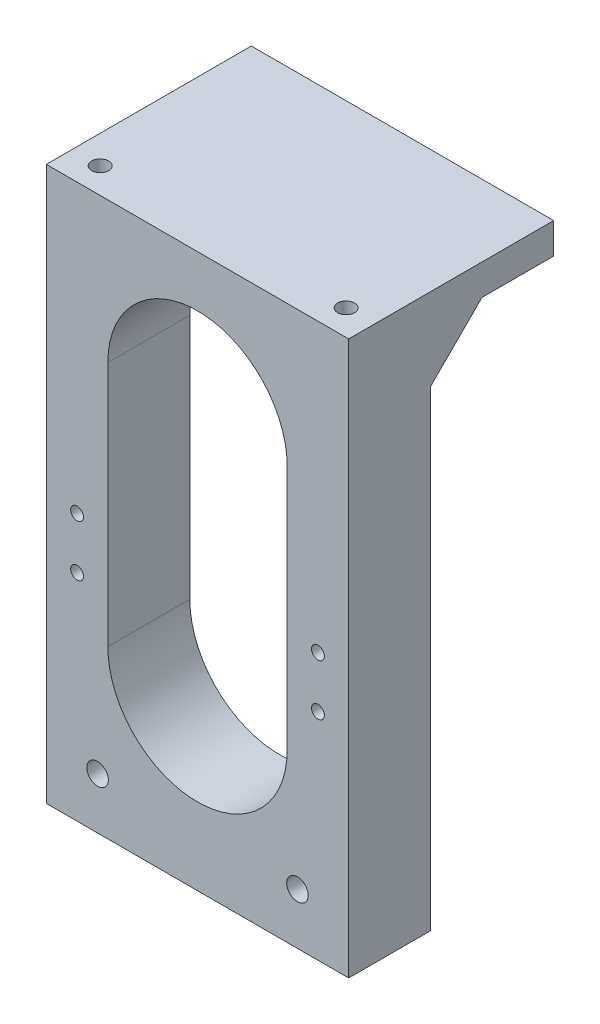
from build123d import *

# Parameters (mm, degrees)
EXTRUDE_2_DEPTH        = 29.5
HOLE_WIZARD_M4_2_D     = 3.3
HOLE_WIZARD_M4_2_DEPTH = 11.5
HOLE_WIZARD_M4_2_TIP   = 0.991420021
CUT_EXTRUDE_1_DEPTH    = 119.887551914
HOLE_WIZARD_M5_1_D     = 4.2
HOLE_WIZARD_M3_1_D     = 2.5
HOLE_WIZARD_M3_1_DEPTH = 8.5
HOLE_WIZARD_M3_1_TIP   = 0.751075774
HOLE_WIZARD_M4_3_D     = 3.3
HOLE_WIZARD_M4_3_DEPTH = 11.5
HOLE_WIZARD_M4_3_TIP   = 0.991420021


with BuildPart() as part:
    # 草图5 → 凸台-拉伸2 (new, symmetric)
    with BuildSketch(Plane(origin=(0, 0, 0), x_dir=(0, 0, -1), z_dir=(1, 0, 0))):
        Polygon((26, 102), (40, 102), (40, 108), (0, 108), (0, 0), (16, 0), (16, 92), align=None)
    extrude(amount=EXTRUDE_2_DEPTH, both=True)

    # M4 螺纹孔2
    with Locations(Plane(origin=(0, 108, 0), x_dir=(1, 0, 0), z_dir=(0, 1, 0))):
        with Locations((24, 5), (-24, 5)):
            Hole(HOLE_WIZARD_M4_2_D / 2, depth=HOLE_WIZARD_M4_2_DEPTH)
            with Locations((0, 0, -(HOLE_WIZARD_M4_2_DEPTH + HOLE_WIZARD_M4_2_TIP / 2))):  # 118° drill point
                Cone(0, HOLE_WIZARD_M4_2_D / 2, HOLE_WIZARD_M4_2_TIP, mode=Mode.SUBTRACT)

    # 草图8 → 切除-拉伸1 (cut, through all)
    with BuildSketch(Plane.XY):
        with BuildLine():
            Line((17.5, 80.5), (17.5, 32.5))
            ThreePointArc((17.5, 32.5), (0, 15), (-17.5, 32.5))
            Line((-17.5, 32.5), (-17.5, 80.5))
            ThreePointArc((-17.5, 80.5), (0, 98), (17.5, 80.5))
        make_face()
    extrude(amount=-CUT_EXTRUDE_1_DEPTH, mode=Mode.SUBTRACT)

    # M5 螺纹孔1 (through all)
    with Locations(Plane.XY):
        with Locations((-19.5, 10), (19.5, 10)):
            Hole(HOLE_WIZARD_M5_1_D / 2)

    # M3 螺纹孔1
    with Locations(Plane.XY):
        with Locations((23.5, 42), (-23.5, 52), (-23.5, 42), (23.5, 52)):
            Hole(HOLE_WIZARD_M3_1_D / 2, depth=HOLE_WIZARD_M3_1_DEPTH)
            with Locations((0, 0, -(HOLE_WIZARD_M3_1_DEPTH + HOLE_WIZARD_M3_1_TIP / 2))):  # 118° drill point
                Cone(0, HOLE_WIZARD_M3_1_D / 2, HOLE_WIZARD_M3_1_TIP, mode=Mode.SUBTRACT)

    # M4 螺纹孔3
    with Locations(Plane(origin=(0, 0, 0), x_dir=(-1, 0, 0), z_dir=(0, -1, 0))):
        with Locations((0, 8)):
            Hole(HOLE_WIZARD_M4_3_D / 2, depth=HOLE_WIZARD_M4_3_DEPTH)
            with Locations((0, 0, -(HOLE_WIZARD_M4_3_DEPTH + HOLE_WIZARD_M4_3_TIP / 2))):  # 118° drill point
                Cone(0, HOLE_WIZARD_M4_3_D / 2, HOLE_WIZARD_M4_3_TIP, mode=Mode.SUBTRACT)


solid = part.part
